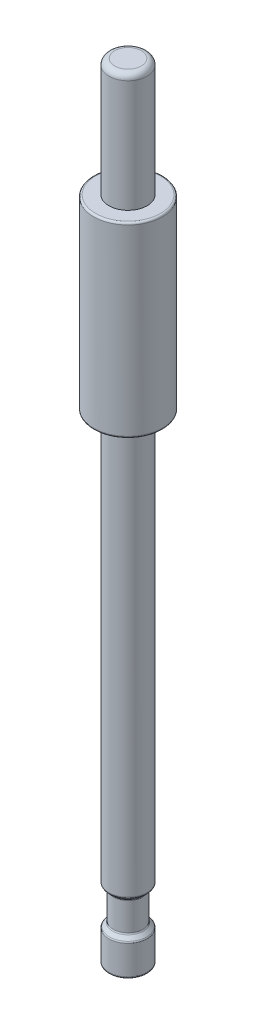
from build123d import *
from OCP.BRepFilletAPI import BRepFilletAPI_MakeFillet

# Parameters (mm, degrees)
FILLET1_R1 = 0.3
FILLET1_R2 = 0.1


with BuildPart() as part:
    # Sketch1 → Revolve1 (revolve)
    with BuildSketch(Plane(origin=(0, 0, 0), x_dir=(0, 0, -1), z_dir=(1, 0, 0))):
        Polygon((-0.975, 0), (-0.975, -6), (-1.75, -6), (-1.75, -15.5), (-0.975, -15.5), (-0.975, -36.275), (-0.75, -36.5), (-0.75, -38), (-0.975, -38.225), (-0.975, -39.789937739), (-0.675, -40), (0, -40), (0, 0), align=None)
    revolve(axis=Axis((0, -45.705406485, 0), (0, 1, 0)))

    # Fillet1: one fillet with a radius per group of edges: ONE call of the kernel's fillet builder (fillet() takes one radius for all edges)
    fillet1_edges_1 = [part.edges().sort_by_distance(p)[0] for p in [
        (0, 0, -0.975),
    ]]
    fillet1_edges_2 = [part.edges().sort_by_distance(p)[0] for p in [
        (0, -15.5, -1.75),
        (0, -6, -1.75),
        (0, -40, -0.675),
        (0, -39.789937739, -0.975),
        (0, -38.225, -0.975),
        (0, -38, -0.75),
        (0, -36.5, -0.75),
        (0, -36.275, -0.975),
    ]]
    fillet1 = BRepFilletAPI_MakeFillet(part.part.solid().wrapped)
    for e in fillet1_edges_1:
        fillet1.Add(FILLET1_R1, e.wrapped)
    for e in fillet1_edges_2:
        fillet1.Add(FILLET1_R2, e.wrapped)
    add(Compound.cast(fillet1.Shape()), mode=Mode.REPLACE)


solid = part.part
